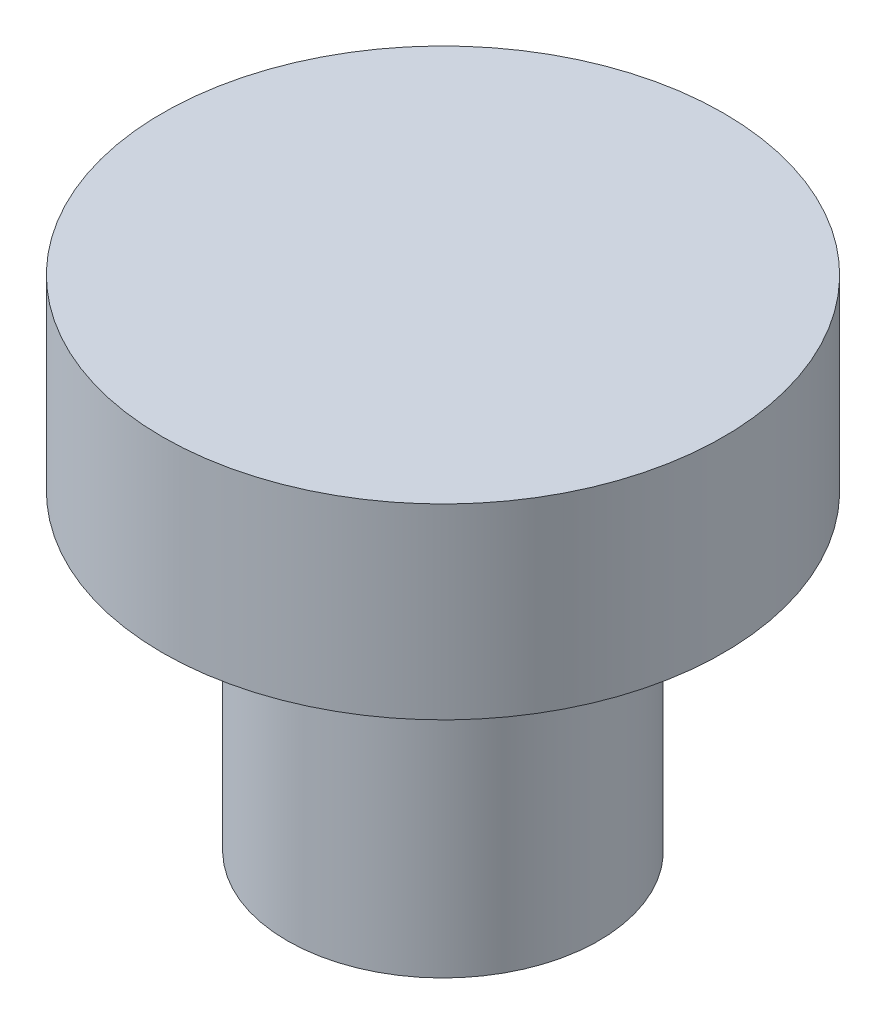
from build123d import *

# Parameters (mm, degrees)
SKETCH1_R    = 4.5
HEAD_DEPTH   = 3
THREAD_START = -5
SKETCH2_R    = 2.5
THREAD_DEPTH = 5


with BuildPart() as part:
    # Sketch1 → Head (new body)
    with BuildSketch(Plane(origin=(0, 0, 0), x_dir=(1, 0, 0), z_dir=(0, 1, 0))):
        with Locations(Location((0, 0, 0), (0, 0, 270))):
            Circle(SKETCH1_R)
    extrude(amount=HEAD_DEPTH)

    # Sketch2 → Thread (add)
    with BuildSketch(Plane(origin=(0, 0, 0), x_dir=(1, 0, 0), z_dir=(0, 1, 0)).offset(THREAD_START)):
        with Locations(Location((0, 0, 0), (0, 0, 270))):
            Circle(SKETCH2_R)
    extrude(amount=THREAD_DEPTH)


solid = part.part
